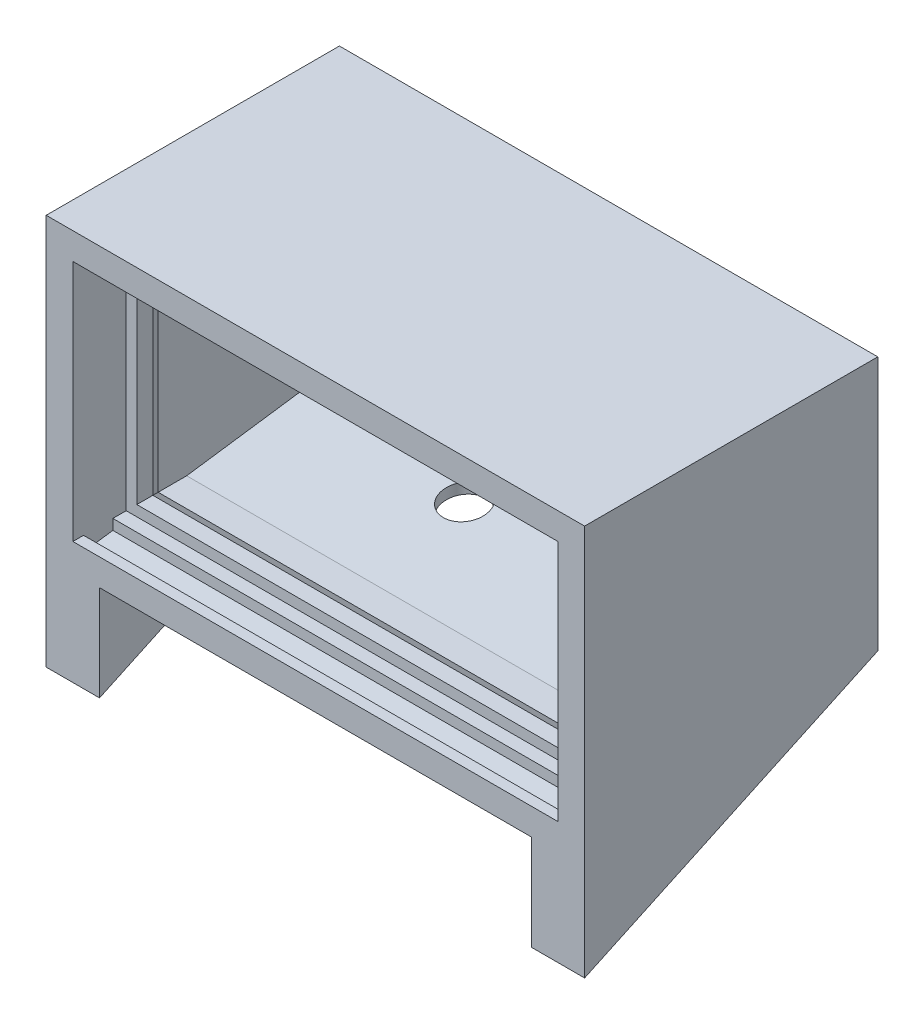
from build123d import *

# Parameters (mm, degrees)
SKETCH_1_W          = 101
SKETCH_1_H          = 55.5
SKETCH_1_W_2        = 91
SKETCH_1_H_2        = 45.5
EXTRUDE_1_DEPTH     = 50
SKETCH_2_W          = 101
SKETCH_2_H          = 55.5
EXTRUDE_2_DEPTH     = 5
SKETCH_4_W          = 101
SKETCH_4_H          = 3
EXTRUDE_3_DEPTH     = 2
SKETCH_7_W          = 91
SKETCH_7_H          = 5.5
CUT_EXTRUDE_1_DEPTH = 3
SKETCH_9_W          = 40
SKETCH_9_H          = 9
CUT_EXTRUDE_2_DEPTH = 3
CUT_EXTRUDE_3_DEPTH = 10
CUT_EXTRUDE_4_DEPTH = 106
EXTRUDE_4_DEPTH     = 100
SKETCH_13_R         = 4
CUT_EXTRUDE_5_DEPTH = 137
SKETCH_14_R         = 3
SKETCH_14_R_2       = 1.5
EXTRUDE_5_DEPTH     = 3
CUT_EXTRUDE_START   = -2
SKETCH_14_3_R       = 1.5
CUT_EXTRUDE_6_DEPTH = 2
EXTRUDE_6_DEPTH     = 3
EXTRUDE_7_DEPTH     = 10
EXTRUDE_9_REACH     = 100.647
EXTRUDE_8_REACH     = 88.283
SKETCH_18_W         = 3
SKETCH_18_H         = 3
SKETCH_19_W         = 5
SKETCH_19_H         = 1.94594374
CUT_EXTRUDE_7_DEPTH = 13
EXTRUDE_10_REACH    = 119.48
EXTRUDE_11_DEPTH    = 86


with BuildPart() as part:
    # 草图1 → 凸台-拉伸1 (new body)
    with BuildSketch(Plane.XY):
        Rectangle(SKETCH_1_W, SKETCH_1_H)
        Rectangle(SKETCH_1_W_2, SKETCH_1_H_2, mode=Mode.SUBTRACT)
    extrude(amount=EXTRUDE_1_DEPTH)

    # 草图2 → 凸台-拉伸2 (add)
    with BuildSketch(Plane.XY):
        Rectangle(SKETCH_2_W, SKETCH_2_H)
    extrude(amount=-EXTRUDE_2_DEPTH)

    # 草图4 → 凸台-拉伸3 (add)
    with BuildSketch(Plane.XZ.offset(-22.75)):
        with Locations((0, 38.5)):
            Rectangle(SKETCH_4_W, SKETCH_4_H)
    extrude(amount=EXTRUDE_3_DEPTH)

    # 草图7 → 切除-拉伸1 (cut)
    with BuildSketch(Plane(origin=(0, -22.75, 0), x_dir=(1, 0, 0), z_dir=(0, 1, 0))):
        with Locations((0, -45.25)):
            Rectangle(SKETCH_7_W, SKETCH_7_H)
    extrude(amount=-CUT_EXTRUDE_1_DEPTH, mode=Mode.SUBTRACT)

    # 草图9 → 切除-拉伸2 (cut)
    with BuildSketch(Plane.XY):
        with Locations((0.5, 18.25)):
            Rectangle(SKETCH_9_W, SKETCH_9_H)
    extrude(amount=-CUT_EXTRUDE_2_DEPTH, mode=Mode.SUBTRACT)

    # 草图10 → 切除-拉伸3 (cut)
    with BuildSketch(Plane(origin=(0, 0, -5), x_dir=(-1, 0, 0), z_dir=(0, 0, -1))):
        with BuildLine():
            Line((-4.5, 18.75), (4.5, 18.75))
            ThreePointArc((4.5, 18.75), (7, 16.25), (4.5, 13.75))
            Line((4.5, 13.75), (-4.5, 13.75))
            ThreePointArc((-4.5, 13.75), (-7, 16.25), (-4.5, 18.75))
        make_face()
    extrude(amount=-CUT_EXTRUDE_3_DEPTH, mode=Mode.SUBTRACT)

    # 草图11 → 切除-拉伸4 (cut)
    with BuildSketch(Plane(origin=(50.5, 0, 0), x_dir=(0, 0, -1), z_dir=(1, 0, 0))):
        Polygon((-50, -27.75), (5, -20.020254091), (5, -27.75), align=None)
    extrude(amount=-CUT_EXTRUDE_4_DEPTH, mode=Mode.SUBTRACT)

    # 草图12 → 凸台-拉伸4 (add)
    with BuildSketch(Plane(origin=(50.5, 0, 0), x_dir=(0, 0, -1), z_dir=(1, 0, 0))):
        Polygon((5, -20.020254091), (5, -18.020254091), (-50, -25.75), (-50, -27.75), align=None)
    extrude(amount=-EXTRUDE_4_DEPTH)

    # 草图13 → 切除-拉伸5 (cut)
    with BuildSketch(Plane(origin=(0, 0, 0), x_dir=(1, 0, 0), z_dir=(0, 1, 0))):
        with Locations(Location((-12.5, -9.5, 0), (0, 0, 90))):
            Circle(SKETCH_13_R)
        with Locations(Location((12.55, -9.5, 0), (0, 0, 90))):
            Circle(SKETCH_13_R)
    extrude(amount=-CUT_EXTRUDE_5_DEPTH, mode=Mode.SUBTRACT)

    # 草图14 → 凸台-拉伸5 (add)
    # profile 1 of 2: a face of its own
    with BuildSketch(Plane.XZ.offset(-22.75)):
        with Locations(Location((-12.5, 9.5, 0), (0, 0, 270))):
            Circle(SKETCH_14_R)
        with Locations(Location((-12.5, 9.5, 0), (0, 0, 270))):
            Circle(SKETCH_14_R_2, mode=Mode.SUBTRACT)
    # profile 2 of 2: a face of its own
    with BuildSketch(Plane.XZ.offset(-22.75)):
        with Locations(Location((12.55, 9.5, 0), (0, 0, 270))):
            Circle(SKETCH_14_R)
        with Locations(Location((12.55, 9.5, 0), (0, 0, 270))):
            Circle(SKETCH_14_R_2, mode=Mode.SUBTRACT)
    extrude(amount=EXTRUDE_5_DEPTH)

    # 草图14<3> → 切除-拉伸6 (cut)
    with BuildSketch(Plane.XZ.offset(-22.75).offset(CUT_EXTRUDE_START)):
        with Locations(Location((-12.5, 9.5, 0), (0, 0, 270))):
            Circle(SKETCH_14_3_R)
        with Locations(Location((12.55, 9.5, 0), (0, 0, 270))):
            Circle(SKETCH_14_3_R)
    extrude(amount=CUT_EXTRUDE_6_DEPTH, mode=Mode.SUBTRACT)

    # 草图15 → 凸台-拉伸6 (add)
    with BuildSketch(Plane.XY.offset(40)):
        Polygon((-45.5, 20.75), (-43.5, 20.75), (-43.5, -20.75), (43.5, -20.75), (43.5, 20.75), (45.5, 20.75), (45.5, -22.75), (43.3124719, -22.75), (-43.5, -22.75), (-45.5, -22.75), align=None)
    extrude(amount=-EXTRUDE_6_DEPTH)

    # 草图17 → 凸台-拉伸7 (add)
    with BuildSketch(Plane(origin=(50.5, 0, 0), x_dir=(0, 0, -1), z_dir=(1, 0, 0))):
        Polygon((-50, -27.75), (-50, -45.66717529), (5, -20.020254091), align=None)
    extrude_7 = extrude(amount=-EXTRUDE_7_DEPTH)

    # 镜向1: 凸台-拉伸7 across plane
    add(extrude_7.mirror(Plane(origin=(0, 0, 0), x_dir=(0, 0, 1), z_dir=(1, 0, 0))))

    # 草图21 → 凸台-拉伸9 (add, up to next)
    with BuildSketch(Plane.XZ.offset(-22.75), mode=Mode.PRIVATE) as extrude_9_sk1:
        Polygon((-45.5, 34), (-45.5, 37), (-43.5, 37), align=None)
    extrude_9_tool1 = extrude(extrude_9_sk1.sketch, amount=EXTRUDE_9_REACH, mode=Mode.PRIVATE) - part.part
    extrude_9 = extrude_9_tool1.solids().sort_by_distance((-44.833333, 22.75, 36))[0]
    add(extrude_9)

    # 镜向2: 凸台-拉伸9 across plane
    add(extrude_9.mirror(Plane(origin=(0, 0, 0), x_dir=(0, 0, 1), z_dir=(1, 0, 0))))

    # 草图18 → 凸台-拉伸8 (add, up to next)
    with BuildSketch(Plane.XY.offset(-3), mode=Mode.PRIVATE) as extrude_8_sk1:
        with Locations((-12.5, 21.25)):
            Rectangle(SKETCH_18_W, SKETCH_18_H)
    extrude_8_tool1 = extrude(extrude_8_sk1.sketch, amount=EXTRUDE_8_REACH, mode=Mode.PRIVATE) - part.part
    # 草图18 → 凸台-拉伸8 (add, up to next)
    with BuildSketch(Plane.XY.offset(-3), mode=Mode.PRIVATE) as extrude_8_sk2:
        with Locations((12.55, 21.25)):
            Rectangle(SKETCH_18_W, SKETCH_18_H)
    extrude_8_tool2 = extrude(extrude_8_sk2.sketch, amount=EXTRUDE_8_REACH, mode=Mode.PRIVATE) - part.part
    add(extrude_8_tool1.solids().sort_by_distance((-12.5, 21.25, -3))[0])
    add(extrude_8_tool2.solids().sort_by_distance((12.55, 21.25, -3))[0])

    # 草图19 → 切除-拉伸7 (cut)
    with BuildSketch(Plane.XY.offset(42.5)):
        with Locations((43, -23.72297187)):
            Rectangle(SKETCH_19_W, SKETCH_19_H)
    extrude(amount=-CUT_EXTRUDE_7_DEPTH, mode=Mode.SUBTRACT)

    # 凸台-拉伸10: up to this plane
    extrude_10_end = Plane(origin=(-43.5, -45.66917529, 37), z_dir=(-0.8320502943378437, 0, 0.5547001962252291))
    # 草图23 → 凸台-拉伸10 (add, up to the surface)
    with BuildSketch(Plane.ZY.offset(-45.5), mode=Mode.PRIVATE) as extrude_10_sk1:
        Polygon((34, 22.75), (37, 22.75), (37, 20.75), align=None)
    extrude_10_tool1 = split(extrude(extrude_10_sk1.sketch, amount=EXTRUDE_10_REACH, mode=Mode.PRIVATE), bisect_by=extrude_10_end, keep=Keep.BOTH, mode=Mode.PRIVATE)
    add(extrude_10_tool1.solids().sort_by_distance((45.5, 22.083333, 36))[0])

    # 草图24 → 凸台-拉伸11 (add)
    with BuildSketch(Plane(origin=(-45.5, 0, 0), x_dir=(0, 0, -1), z_dir=(1, 0, 0))):
        Polygon((-34, -22.75), (-37, -22.75), (-37, -20.75), align=None)
    extrude(amount=EXTRUDE_11_DEPTH)


solid = part.part
